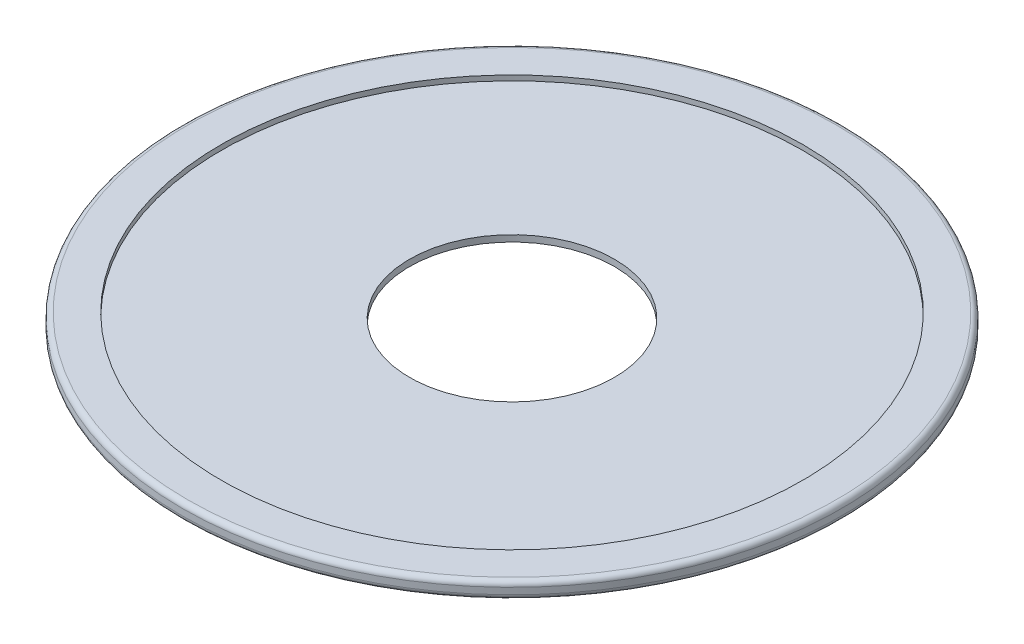
from build123d import *

# Parameters (mm, degrees)
SKETCH1_W = 165.1
SKETCH1_H = 4.7625


with BuildPart() as part:
    # Sketch1 → Revolve1 (revolve)
    with BuildSketch(Plane.XY, mode=Mode.PRIVATE) as revolve1_sk:
        with Locations((158.75, 2.38125)):
            Rectangle(SKETCH1_W, SKETCH1_H)
    revolve(revolve1_sk.sketch.rotate(Axis((0, -187.080769231, 0), (0, 1, 0)), 90), axis=Axis((0, -187.080769231, 0), (0, 1, 0)))

    # Sketch2 → Revolve2 (revolve)
    with BuildSketch(Plane.XY, mode=Mode.PRIVATE) as revolve2_sk:
        with BuildLine():
            Line((216.3, -3.81), (241.3, -3.81))
            ThreePointArc((241.3, -3.81), (243.994076836, -2.694076836), (245.11, 0))
            Line((245.11, 0), (245.11, 4.7625))
            ThreePointArc((245.11, 4.7625), (243.994076836, 7.456576836), (241.3, 8.5725))
            Line((241.3, 8.5725), (216.3, 8.5725))
            Line((216.3, 8.5725), (216.3, 4.7625))
            Line((216.3, 4.7625), (241.3, 4.7625))
            Line((241.3, 4.7625), (241.3, 0))
            Line((241.3, 0), (216.3, 0))
            Line((216.3, 0), (216.3, -3.81))
        make_face()
    revolve(revolve2_sk.sketch.rotate(Axis((0, 0, 0), (0, 1, 0)), 90), axis=Axis((0, 0, 0), (0, 1, 0)))


solid = part.part
